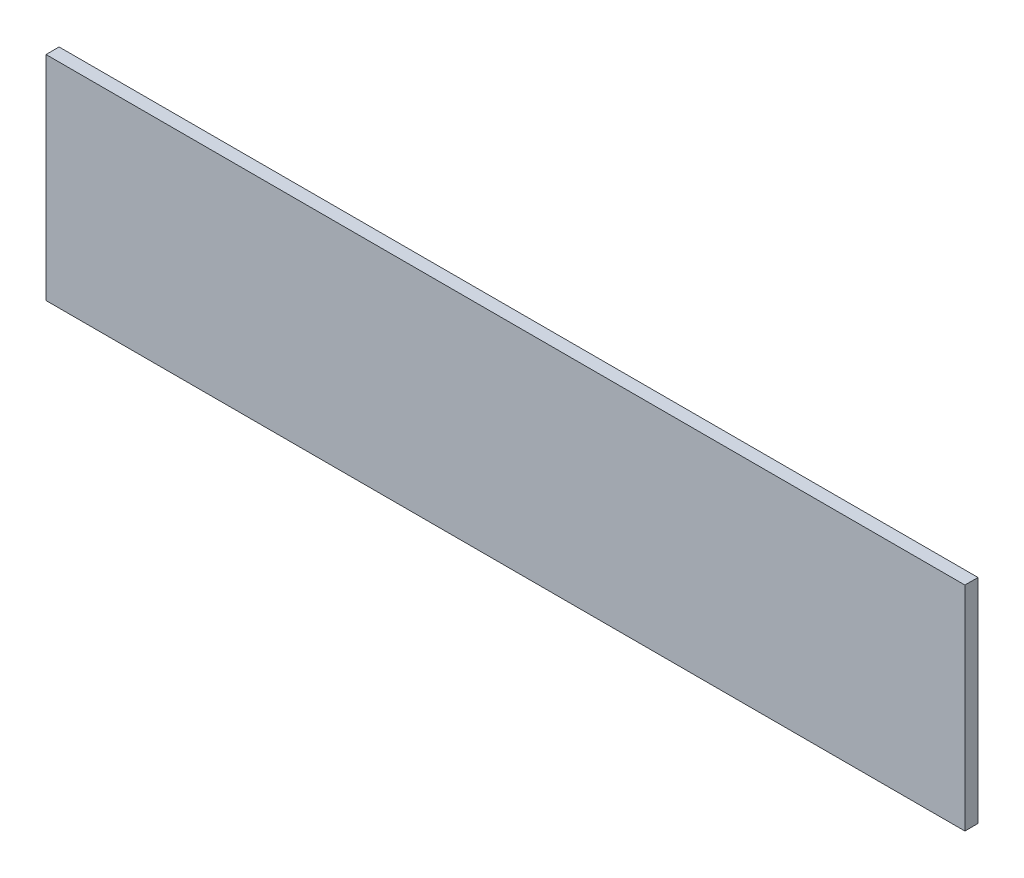
from build123d import *

# Parameters (mm, degrees)
SKETCH1_W           = 219.075
SKETCH1_H           = 50.8
BOSS_EXTRUDE1_DEPTH = 3.1242


with BuildPart() as part:
    # Sketch1 → Boss-Extrude1 (new body)
    with BuildSketch(Plane.XY):
        with Locations((-118.11, 47.069375)):
            Rectangle(SKETCH1_W, SKETCH1_H)
    extrude(amount=BOSS_EXTRUDE1_DEPTH)


solid = part.part
